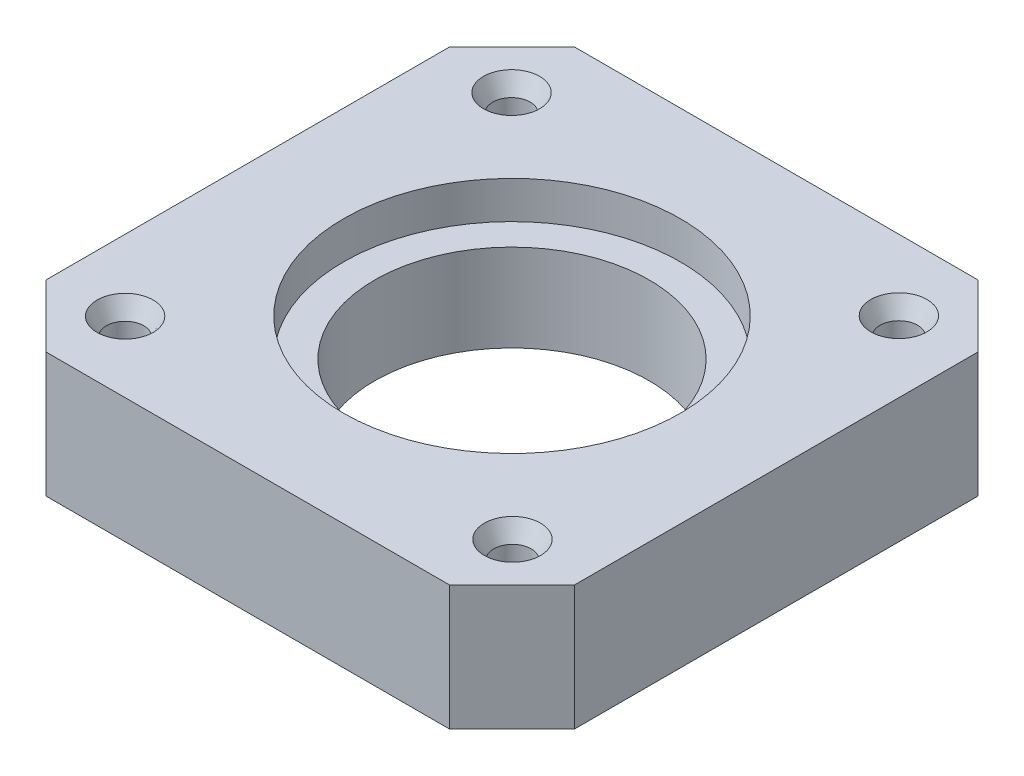
from build123d import *

# Parameters (mm, degrees)
SKETCH1_R                    = 33.334829616
SKETCH1_R_2                  = 11
EXTRUDE1_DEPTH               = 10
SKETCH2_W                    = 68.7469374
SKETCH2_H                    = 68.7469374
CUT_EXTRUDE1_DEPTH           = 10
SKETCH3_R                    = 1.5
CUT_EXTRUDE2_DEPTH           = 32.563829392
SKETCH4_R                    = 2.25
CUT_EXTRUDE3_DEPTH           = 1.5
CUT_EXTRUDE3_DRAFT           = -28
CUT_EXTRUDE3_PROFILE_2_DEPTH = 1.5
CUT_EXTRUDE3_PROFILE_2_DRAFT = -28
CUT_EXTRUDE3_PROFILE_3_DEPTH = 1.5
CUT_EXTRUDE3_PROFILE_3_DRAFT = -28
CUT_EXTRUDE3_PROFILE_4_DEPTH = 1.5
CUT_EXTRUDE3_PROFILE_4_DRAFT = -28
SKETCH5_R                    = 13.5
CUT_EXTRUDE4_DEPTH           = 3


with BuildPart() as part:
    # Sketch1 → Extrude1 (new body)
    with BuildSketch(Plane(origin=(0, 0, 0), x_dir=(1, 0, 0), z_dir=(0, 1, 0))):
        with Locations(Location((0, 0, 0), (0, 0, 270))):
            Circle(SKETCH1_R)
        with Locations(Location((0, 0, 0), (0, 0, 270))):
            Circle(SKETCH1_R_2, mode=Mode.SUBTRACT)
    extrude(amount=EXTRUDE1_DEPTH)

    # Sketch2 → Cut-Extrude1 (cut)
    with BuildSketch(Plane.XZ):
        Rectangle(SKETCH2_W, SKETCH2_H)
        Polygon((16.16926222, 21.16926222), (21.16926222, 16.16926222), (21.16926222, -16.16926222), (16.16926222, -21.16926222), (-16.16926222, -21.16926222), (-21.16926222, -16.16926222), (-21.16926222, 16.16926222), (-16.16926222, 21.16926222), align=None, mode=Mode.SUBTRACT)
    extrude(amount=-CUT_EXTRUDE1_DEPTH, mode=Mode.SUBTRACT)

    # Sketch3 → Cut-Extrude2 (cut, through all)
    with BuildSketch(Plane(origin=(0, 10, 0), x_dir=(1, 0, 0), z_dir=(0, 1, 0))):
        with Locations(Location((-15.518439578, 15.481538459, 0), (0, 0, 270))):
            Circle(SKETCH3_R)
        with Locations(Location((-15.481538459, -15.518439578, 0), (0, 0, 270))):
            Circle(SKETCH3_R)
        with Locations(Location((15.481538459, 15.518439578, 0), (0, 0, 270))):
            Circle(SKETCH3_R)
        with Locations(Location((15.518439578, -15.481538459, 0), (0, 0, 270))):
            Circle(SKETCH3_R)
    extrude(amount=-CUT_EXTRUDE2_DEPTH, mode=Mode.SUBTRACT)


with BuildPart() as cut_extrude3_tool:
    # Sketch4 → Cut-Extrude3 (with draft: the straight prism first)
    with BuildSketch(Plane(origin=(0, 10, 0), x_dir=(1, 0, 0), z_dir=(0, 1, 0))):
        with Locations((-15.518439578, 15.481538459)):
            Circle(SKETCH4_R)
    extrude(amount=-CUT_EXTRUDE3_DEPTH)
    # Cut-Extrude3: the draft: its side faces are tilted about the plane it starts from
    cut_extrude3_sides = [cut_extrude3_tool.faces().sort_by_distance(p)[0] for p in [
        (-17.768439578, 9.25, -15.481538459),
    ]]
    draft(cut_extrude3_sides, Plane(origin=(0, 10, 0), x_dir=(1, 0, 0), z_dir=(0, 1, 0)), CUT_EXTRUDE3_DRAFT)


with BuildPart() as part_1:
    add(part.part)

    # Cut-Extrude3: cut by cut_extrude3_tool
    add(cut_extrude3_tool.part, mode=Mode.SUBTRACT)


with BuildPart() as cut_extrude3_profile_2_tool:
    # Sketch4 → Cut-Extrude3 profile 2 (with draft: the straight prism first)
    with BuildSketch(Plane(origin=(0, 10, 0), x_dir=(1, 0, 0), z_dir=(0, 1, 0))):
        with Locations((-15.481538459, -15.518439578)):
            Circle(SKETCH4_R)
    extrude(amount=-CUT_EXTRUDE3_PROFILE_2_DEPTH)
    # Cut-Extrude3 profile 2: the draft: its side faces are tilted about the plane it starts from
    cut_extrude3_profile_2_sides = [cut_extrude3_profile_2_tool.faces().sort_by_distance(p)[0] for p in [
        (-17.731538459, 9.25, 15.518439578),
    ]]
    draft(cut_extrude3_profile_2_sides, Plane(origin=(0, 10, 0), x_dir=(1, 0, 0), z_dir=(0, 1, 0)), CUT_EXTRUDE3_PROFILE_2_DRAFT)


with BuildPart() as part_2:
    add(part_1.part)

    # Cut-Extrude3 profile 2: cut by cut_extrude3_profile_2_tool
    add(cut_extrude3_profile_2_tool.part, mode=Mode.SUBTRACT)


with BuildPart() as cut_extrude3_profile_3_tool:
    # Sketch4 → Cut-Extrude3 profile 3 (with draft: the straight prism first)
    with BuildSketch(Plane(origin=(0, 10, 0), x_dir=(1, 0, 0), z_dir=(0, 1, 0))):
        with Locations((15.481538459, 15.518439578)):
            Circle(SKETCH4_R)
    extrude(amount=-CUT_EXTRUDE3_PROFILE_3_DEPTH)
    # Cut-Extrude3 profile 3: the draft: its side faces are tilted about the plane it starts from
    cut_extrude3_profile_3_sides = [cut_extrude3_profile_3_tool.faces().sort_by_distance(p)[0] for p in [
        (13.231538459, 9.25, -15.518439578),
    ]]
    draft(cut_extrude3_profile_3_sides, Plane(origin=(0, 10, 0), x_dir=(1, 0, 0), z_dir=(0, 1, 0)), CUT_EXTRUDE3_PROFILE_3_DRAFT)


with BuildPart() as part_3:
    add(part_2.part)

    # Cut-Extrude3 profile 3: cut by cut_extrude3_profile_3_tool
    add(cut_extrude3_profile_3_tool.part, mode=Mode.SUBTRACT)


with BuildPart() as cut_extrude3_profile_4_tool:
    # Sketch4 → Cut-Extrude3 profile 4 (with draft: the straight prism first)
    with BuildSketch(Plane(origin=(0, 10, 0), x_dir=(1, 0, 0), z_dir=(0, 1, 0))):
        with Locations((15.518439578, -15.481538459)):
            Circle(SKETCH4_R)
    extrude(amount=-CUT_EXTRUDE3_PROFILE_4_DEPTH)
    # Cut-Extrude3 profile 4: the draft: its side faces are tilted about the plane it starts from
    cut_extrude3_profile_4_sides = [cut_extrude3_profile_4_tool.faces().sort_by_distance(p)[0] for p in [
        (13.268439578, 9.25, 15.481538459),
    ]]
    draft(cut_extrude3_profile_4_sides, Plane(origin=(0, 10, 0), x_dir=(1, 0, 0), z_dir=(0, 1, 0)), CUT_EXTRUDE3_PROFILE_4_DRAFT)


with BuildPart() as part_4:
    add(part_3.part)

    # Cut-Extrude3 profile 4: cut by cut_extrude3_profile_4_tool
    add(cut_extrude3_profile_4_tool.part, mode=Mode.SUBTRACT)

    # Sketch5 → Cut-Extrude4 (cut)
    with BuildSketch(Plane(origin=(0, 10, 0), x_dir=(1, 0, 0), z_dir=(0, 1, 0))):
        with Locations(Location((0, 0, 0), (0, 0, 270))):
            Circle(SKETCH5_R)
    extrude(amount=-CUT_EXTRUDE4_DEPTH, mode=Mode.SUBTRACT)


solid = part_4.part
